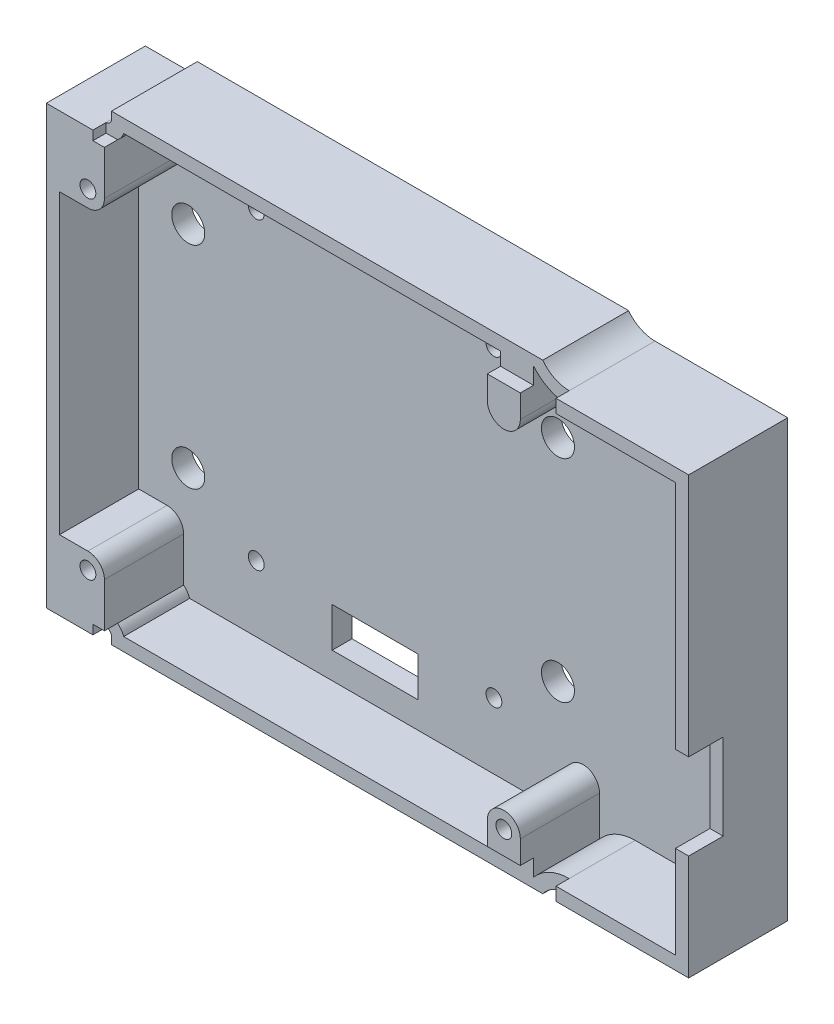
from build123d import *

# Parameters (mm, degrees)
SKIZZE1_W                            = 12
SKIZZE1_H                            = 77.4
AUFSATZ_LINEAR_AUSTRAGEN1_DEPTH      = 15
SCHNITT_LINEAR_AUSTRAGEN1_DEPTH      = 12
SKIZZE3_R                            = 1.2
SCHNITT_LINEAR_AUSTRAGEN2_DEPTH      = 10
SKIZZE4_W                            = 5.22
SKIZZE4_H                            = 13
SCHNITT_LINEAR_AUSTRAGEN3_DEPTH      = 5
SCHNITT_LINEAR_AUSTRAGEN4_DEPTH      = 64.949296321
SCHNITT_LINEAR_AUSTRAGEN4_DEPTH_BACK = 64.949296321
SKIZZE5_R                            = 1.2
SCHNITT_LINEAR_AUSTRAGEN5_DEPTH      = 64.949296321
SCHNITT_LINEAR_AUSTRAGEN5_DEPTH_BACK = 64.949296321
SKIZZE6_R                            = 2.5
SCHNITT_LINEAR_AUSTRAGEN6_DEPTH      = 64.949296321
SCHNITT_LINEAR_AUSTRAGEN6_DEPTH_BACK = 64.949296321
SKIZZE7_W                            = 13
SKIZZE7_H                            = 6
AUFSATZ_LINEAR_START                 = 12
SKIZZE8_R                            = 2.5
SKIZZE8_R_2                          = 1.200003308
SKIZZE8_R_3                          = 1.2
AUFSATZ_LINEAR_AUSTRAGEN2_DEPTH      = 12
SKIZZE9_R                            = 1.2
SKIZZE9_R_2                          = 1.200003308
AUFSATZ_LINEAR_AUSTRAGEN3_DEPTH      = 12
SCHNITT_LINEAR_AUSTRAGEN7_DEPTH      = 64.949296321
SCHNITT_LINEAR_AUSTRAGEN7_DEPTH_BACK = 64.949296321
SKIZZE10_W                           = 76.97303699
SKIZZE10_H                           = 5.16089798
SCHNITT_LINEAR_AUSTRAGEN8_DEPTH      = 2


with BuildPart() as part:
    # Skizze1 → Aufsatz-Linear austragen1 (new body)
    with BuildSketch(Plane.XY):
        with BuildLine():
            ThreePointArc((-40.78, -33.92), (-41.017243507, -33.347243507), (-41.59, -33.11))
            Line((-41.59, -33.11), (-48.65, -33.11))
            Line((-48.65, -33.11), (-48.65, 33.11))
            Line((-48.65, 33.11), (-41.59, 33.11))
            ThreePointArc((-41.59, 33.11), (-41.017243507, 33.347243507), (-40.78, 33.92))
            Line((-40.78, 33.92), (-40.78, 38.7))
            Line((-40.78, 38.7), (-39.35, 38.7))
            Line((-39.35, 38.7), (-39.35, -38.7))
            Line((-39.35, -38.7), (-40.78, -38.7))
            Line((-40.78, -38.7), (-40.78, -33.92))
        make_face()
        with Locations((-33.35, 0)):
            Rectangle(SKIZZE1_W, SKIZZE1_H)
        with BuildLine():
            ThreePointArc((9.355872211, 33.3), (8.489846807, 33.224428901), (7.65, 33))
            Line((7.65, 33), (-24.35, 33))
            Line((-24.35, 33), (-24.35, -33))
            Line((-24.35, -33), (7.65, -33))
            ThreePointArc((7.65, -33), (8.489846807, -33.224428901), (9.355872211, -33.3))
            Line((9.355872211, -33.3), (17.45, -33.3))
            Line((17.45, -33.3), (17.45, -24))
            Line((17.45, -24), (23.85, -24))
            Line((23.85, -24), (23.85, -30))
            Line((23.85, -30), (34.2, -30))
            Line((34.2, -30), (45.65, -30))
            Line((45.65, -30), (45.65, 3))
            Line((45.65, 3), (48.65, 3))
            Line((48.65, 3), (48.65, -33))
            Line((48.65, -33), (34.2, -33))
            Line((34.2, -33), (28.552127178, -33))
            ThreePointArc((28.552127178, -33), (25.679845855, -33.907323614), (23.85, -36.3))
            Line((23.85, -36.3), (5.65, -36.3))
            ThreePointArc((5.65, -36.3), (4.089741294, -35.336310473), (2.286965656, -35))
            Line((2.286965656, -35), (-20.521956918, -35))
            ThreePointArc((-20.521956918, -35), (-23.563338183, -36.031373033), (-25.35, -38.7))
            Line((-25.35, -38.7), (-27.35, -38.7))
            Line((-27.35, -38.7), (-27.35, 38.7))
            Line((-27.35, 38.7), (-25.35, 38.7))
            ThreePointArc((-25.35, 38.7), (-23.563338183, 36.031373033), (-20.521956918, 35))
            Line((-20.521956918, 35), (2.286965656, 35))
            ThreePointArc((2.286965656, 35), (4.089741294, 35.336310473), (5.65, 36.3))
            Line((5.65, 36.3), (23.85, 36.3))
            ThreePointArc((23.85, 36.3), (25.679845855, 33.907323614), (28.552127178, 33))
            Line((28.552127178, 33), (34.2, 33))
            Line((34.2, 33), (48.65, 33))
            Line((48.65, 33), (48.65, 18))
            Line((48.65, 18), (45.65, 18))
            Line((45.65, 18), (45.65, 30))
            Line((45.65, 30), (34.2, 30))
            Line((34.2, 30), (23.85, 30))
            Line((23.85, 30), (23.85, 24))
            Line((23.85, 24), (17.45, 24))
            Line((17.45, 24), (17.45, 33.3))
            Line((17.45, 33.3), (9.355872211, 33.3))
        make_face()
        with BuildLine():
            Line((9.355872211, 33.3), (17.45, 33.3))
            Line((17.45, 33.3), (17.45, 24))
            Line((17.45, 24), (23.85, 24))
            Line((23.85, 24), (23.85, 30))
            Line((23.85, 30), (34.2, 30))
            Line((34.2, 30), (45.65, 30))
            Line((45.65, 30), (45.65, 18))
            Line((45.65, 18), (48.65, 18))
            Line((48.65, 18), (48.65, 3))
            Line((48.65, 3), (45.65, 3))
            Line((45.65, 3), (45.65, -30))
            Line((45.65, -30), (34.2, -30))
            Line((34.2, -30), (23.85, -30))
            Line((23.85, -30), (23.85, -24))
            Line((23.85, -24), (17.45, -24))
            Line((17.45, -24), (17.45, -33.3))
            Line((17.45, -33.3), (9.355872211, -33.3))
            ThreePointArc((9.355872211, -33.3), (8.489846807, -33.224428901), (7.65, -33))
            Line((7.65, -33), (-24.35, -33))
            Line((-24.35, -33), (-24.35, 33))
            Line((-24.35, 33), (7.65, 33))
            ThreePointArc((7.65, 33), (8.489846807, 33.224428901), (9.355872211, 33.3))
        make_face()
    extrude(amount=AUFSATZ_LINEAR_AUSTRAGEN1_DEPTH)

    # Skizze2 → Schnitt-Linear austragen1 (cut)
    with BuildSketch(Plane.XY.offset(15)):
        with BuildLine():
            Line((46.65, -31), (46.65, 31))
            Line((46.65, 31), (28.552127178, 31))
            ThreePointArc((28.552127178, 31), (25.153598085, 31.880359488), (22.609905372, 34.3))
            Line((22.609905372, 34.3), (6.350215587, 34.3))
            ThreePointArc((6.350215587, 34.3), (4.420038557, 33.33291668), (2.286965656, 33))
            Line((2.286965656, 33), (-20.521956918, 33))
            ThreePointArc((-20.521956918, 33), (-24.120567761, 33.995834779), (-26.695286652, 36.7))
            Line((-26.695286652, 36.7), (-38.78, 36.7))
            Line((-38.78, 36.7), (-38.78, 33.92))
            ThreePointArc((-38.78, 33.92), (-39.603029945, 31.933029945), (-41.59, 31.11))
            Line((-41.59, 31.11), (-46.65, 31.11))
            Line((-46.65, 31.11), (-46.65, -31.11))
            Line((-46.65, -31.11), (-41.59, -31.11))
            ThreePointArc((-41.59, -31.11), (-39.603029945, -31.933029945), (-38.78, -33.92))
            Line((-38.78, -33.92), (-38.78, -36.7))
            Line((-38.78, -36.7), (-26.695286652, -36.7))
            ThreePointArc((-26.695286652, -36.7), (-24.120567761, -33.995834779), (-20.521956918, -33))
            Line((-20.521956918, -33), (2.286965656, -33))
            ThreePointArc((2.286965656, -33), (4.420038557, -33.33291668), (6.350215587, -34.3))
            Line((6.350215587, -34.3), (22.609905372, -34.3))
            ThreePointArc((22.609905372, -34.3), (25.153598085, -31.880359488), (28.552127178, -31))
            Line((28.552127178, -31), (46.65, -31))
        make_face()
    extrude(amount=-SCHNITT_LINEAR_AUSTRAGEN1_DEPTH, mode=Mode.SUBTRACT)

    # Skizze3 → Schnitt-Linear austragen2 (cut)
    with BuildSketch(Plane.XY.offset(3)):
        with Locations((-42.35, 25)):
            Circle(SKIZZE3_R)
        with Locations((20.650001099, 27.499992502)):
            Circle(SKIZZE3_R)
        with Locations((20.650001099, -27.499992502)):
            Circle(SKIZZE3_R)
        with Locations((-42.35, -25)):
            Circle(SKIZZE3_R)
    extrude(amount=-SCHNITT_LINEAR_AUSTRAGEN2_DEPTH, mode=Mode.SUBTRACT)

    # Skizze4 → Schnitt-Linear austragen3 (cut)
    with BuildSketch(Plane(origin=(48.65, 0, 0), x_dir=(0, 0, -1), z_dir=(1, 0, 0))):
        with Locations((-12.39, -10.5)):
            Rectangle(SKIZZE4_W, SKIZZE4_H)
    extrude(amount=-SCHNITT_LINEAR_AUSTRAGEN3_DEPTH, mode=Mode.SUBTRACT)

    # Skizze5 → Schnitt-Linear austragen4 (cut, two sides: drawn at the far end of the back side and taken through both)
    with BuildSketch(Plane(origin=(0, 0, 0), x_dir=(-1, 0, 0), z_dir=(0, 0, -1)).offset(-SCHNITT_LINEAR_AUSTRAGEN4_DEPTH_BACK)):
        with Locations((-7.15000055, 23)):
            Circle(SKIZZE5_R)
        with Locations((28.84999945, 23)):
            Circle(SKIZZE5_R)
        with Locations((-7.15000055, -23)):
            Circle(SKIZZE5_R)
        with Locations((28.84999945, -23)):
            Circle(SKIZZE5_R)
    extrude(amount=SCHNITT_LINEAR_AUSTRAGEN4_DEPTH + SCHNITT_LINEAR_AUSTRAGEN4_DEPTH_BACK, mode=Mode.SUBTRACT)

    # Skizze6 → Schnitt-Linear austragen5 (cut, two sides: drawn at the far end of the back side and taken through both)
    with BuildSketch(Plane(origin=(0, 0, 0), x_dir=(-1, 0, 0), z_dir=(0, 0, -1)).offset(-SCHNITT_LINEAR_AUSTRAGEN5_DEPTH_BACK)):
        with Locations((-16.85, -16)):
            Circle(SKIZZE6_R)
        with Locations(Location((-16.85, 16, 0), (0, 0, 180))):
            Circle(SKIZZE6_R)
        with Locations((39.15, 16)):
            Circle(SKIZZE6_R)
        with Locations(Location((39.15, -16, 0), (0, 0, 180))):
            Circle(SKIZZE6_R)
    extrude(amount=SCHNITT_LINEAR_AUSTRAGEN5_DEPTH + SCHNITT_LINEAR_AUSTRAGEN5_DEPTH_BACK, mode=Mode.SUBTRACT)

    # Skizze7 → Schnitt-Linear austragen6 (cut, two sides: drawn at the far end of the back side and taken through both)
    with BuildSketch(Plane(origin=(0, 0, 0), x_dir=(-1, 0, 0), z_dir=(0, 0, -1)).offset(-SCHNITT_LINEAR_AUSTRAGEN6_DEPTH_BACK)):
        with Locations((10.84999945, -26)):
            Rectangle(SKIZZE7_W, SKIZZE7_H)
        with Locations((10.84999945, 26)):
            Rectangle(SKIZZE7_W, SKIZZE7_H)
    extrude(amount=SCHNITT_LINEAR_AUSTRAGEN6_DEPTH + SCHNITT_LINEAR_AUSTRAGEN6_DEPTH_BACK, mode=Mode.SUBTRACT)

    # Skizze8 → Aufsatz-Linear austragen2 (add)
    # profile 1 of 4: a face of its own
    with BuildSketch(Plane.XY.offset(3).offset(AUFSATZ_LINEAR_START)):
        with Locations((-42.35, 25)):
            Circle(SKIZZE8_R)
        with Locations((-42.35, 25)):
            Circle(SKIZZE8_R_2, mode=Mode.SUBTRACT)
    # profile 2 of 4: a face of its own
    with BuildSketch(Plane.XY.offset(3).offset(AUFSATZ_LINEAR_START)):
        with Locations(Location((-42.35, -25, 0), (0, 0, 180))):
            Circle(SKIZZE8_R)
        with Locations((-42.35, -25)):
            Circle(SKIZZE8_R_2, mode=Mode.SUBTRACT)
    # profile 3 of 4: a face of its own
    with BuildSketch(Plane.XY.offset(3).offset(AUFSATZ_LINEAR_START)):
        with Locations((20.650001099, 27.499992502)):
            Circle(SKIZZE8_R)
        with Locations((20.650001099, 27.499992502)):
            Circle(SKIZZE8_R_3, mode=Mode.SUBTRACT)
    # profile 4 of 4: a face of its own
    with BuildSketch(Plane.XY.offset(3).offset(AUFSATZ_LINEAR_START)):
        with Locations(Location((20.650001099, -27.499992502, 0), (0, 0, 180))):
            Circle(SKIZZE8_R)
        with Locations((20.650001099, -27.499992502)):
            Circle(SKIZZE8_R_3, mode=Mode.SUBTRACT)
    extrude(amount=-AUFSATZ_LINEAR_AUSTRAGEN2_DEPTH)

    # Skizze9 → Aufsatz-Linear austragen3 (add)
    # profile 1 of 6: a face of its own
    with BuildSketch(Plane.XY.offset(3).offset(AUFSATZ_LINEAR_START)):
        with BuildLine():
            Line((-39.85, 25), (-39.85, 31.933029945))
            Line((-39.85, 31.933029945), (-46.65, 31.933029945))
            Line((-46.65, 31.933029945), (-46.65, 22.5))
            Line((-46.65, 22.5), (-42.35, 22.5))
            ThreePointArc((-42.35, 22.5), (-40.582233047, 23.232233047), (-39.85, 25))
        make_face()
        with Locations((-42.35, 25)):
            Circle(SKIZZE9_R, mode=Mode.SUBTRACT)
    # profile 2 of 6: a face of its own
    with BuildSketch(Plane.XY.offset(3).offset(AUFSATZ_LINEAR_START)):
        with BuildLine():
            Line((18.150001099, 33), (18.150001099, 27.499992502))
            ThreePointArc((18.150001099, 27.499992502), (20.650001099, 24.999992502), (23.150001099, 27.499992502))
            Line((23.150001099, 27.499992502), (23.150001099, 34.3))
            Line((23.150001099, 34.3), (24.552127178, 34.3))
            Line((24.552127178, 34.3), (24.552127178, 35))
            Line((24.552127178, 35), (2.286965656, 35))
            Line((2.286965656, 35), (2.286965656, 33))
            Line((2.286965656, 33), (18.150001099, 33))
        make_face()
    # profile 3 of 6: a face of its own
    with BuildSketch(Plane.XY.offset(3).offset(AUFSATZ_LINEAR_START)):
        with BuildLine():
            Line((-46.65, -22.5), (-42.35, -22.5))
            ThreePointArc((-42.35, -22.5), (-40.582233047, -23.232233047), (-39.85, -25))
            Line((-39.85, -25), (-39.85, -31.933029945))
            Line((-39.85, -31.933029945), (-46.65, -31.933029945))
            Line((-46.65, -31.933029945), (-46.65, -22.5))
        make_face()
        with Locations((-42.35, -25)):
            Circle(SKIZZE9_R, mode=Mode.SUBTRACT)
    # profile 4 of 6: a face of its own
    with BuildSketch(Plane.XY.offset(3).offset(AUFSATZ_LINEAR_START)):
        Polygon((-20.521956918, -33), (-38.934872884, -33), (-38.78, -35), (-20.521956918, -35), align=None)
    # profile 5 of 6: a face of its own
    with BuildSketch(Plane.XY.offset(3).offset(AUFSATZ_LINEAR_START)):
        Polygon((-20.521956918, 33), (-20.521956918, 35), (-38.78, 35), (-38.934872884, 33), align=None)
    # profile 6 of 6: a face of its own
    with BuildSketch(Plane.XY.offset(3).offset(AUFSATZ_LINEAR_START)):
        with BuildLine():
            Line((2.286965656, -35), (2.286965656, -33))
            Line((2.286965656, -33), (18.150001099, -33))
            Line((18.150001099, -33), (18.150001099, -27.499992502))
            ThreePointArc((18.150001099, -27.499992502), (20.650001099, -24.999992502), (23.150001099, -27.499992502))
            Line((23.150001099, -27.499992502), (23.150001099, -34.3))
            Line((23.150001099, -34.3), (24.552127178, -34.3))
            Line((24.552127178, -34.3), (24.552127178, -35))
            Line((24.552127178, -35), (2.286965656, -35))
        make_face()
        with Locations((20.650001099, -27.499992502)):
            Circle(SKIZZE9_R_2, mode=Mode.SUBTRACT)
    extrude(amount=-AUFSATZ_LINEAR_AUSTRAGEN3_DEPTH)

    # Skizze10 → Schnitt-Linear austragen7 (cut, two sides: drawn at the far end of the back side and taken through both)
    with BuildSketch(Plane.XY.offset(15).offset(-SCHNITT_LINEAR_AUSTRAGEN7_DEPTH_BACK)):
        with Locations((-2.293481505, 37.58044899)):
            Rectangle(SKIZZE10_W, SKIZZE10_H)
        with Locations((-2.293481505, -37.58044899)):
            Rectangle(SKIZZE10_W, SKIZZE10_H)
    extrude(amount=SCHNITT_LINEAR_AUSTRAGEN7_DEPTH + SCHNITT_LINEAR_AUSTRAGEN7_DEPTH_BACK, mode=Mode.SUBTRACT)

    # Skizze11 → Schnitt-Linear austragen8 (cut)
    with BuildSketch(Plane.XY.offset(15)):
        Polygon((-41.59, 31.713532235), (-41.59, 35), (28.552127178, 35), (28.552127178, 31), (18.150001099, 31), (18.150001099, 33), (-38.934872884, 33), (-38.934872884, 31.713532235), align=None)
        Polygon((-38.934872884, -33), (-38.934872884, -31.713532235), (-41.59, -31.713532235), (-41.59, -35), (28.552127178, -35), (28.552127178, -31), (18.150001099, -31), (18.150001099, -33), align=None)
    extrude(amount=-SCHNITT_LINEAR_AUSTRAGEN8_DEPTH, mode=Mode.SUBTRACT)


solid = part.part
